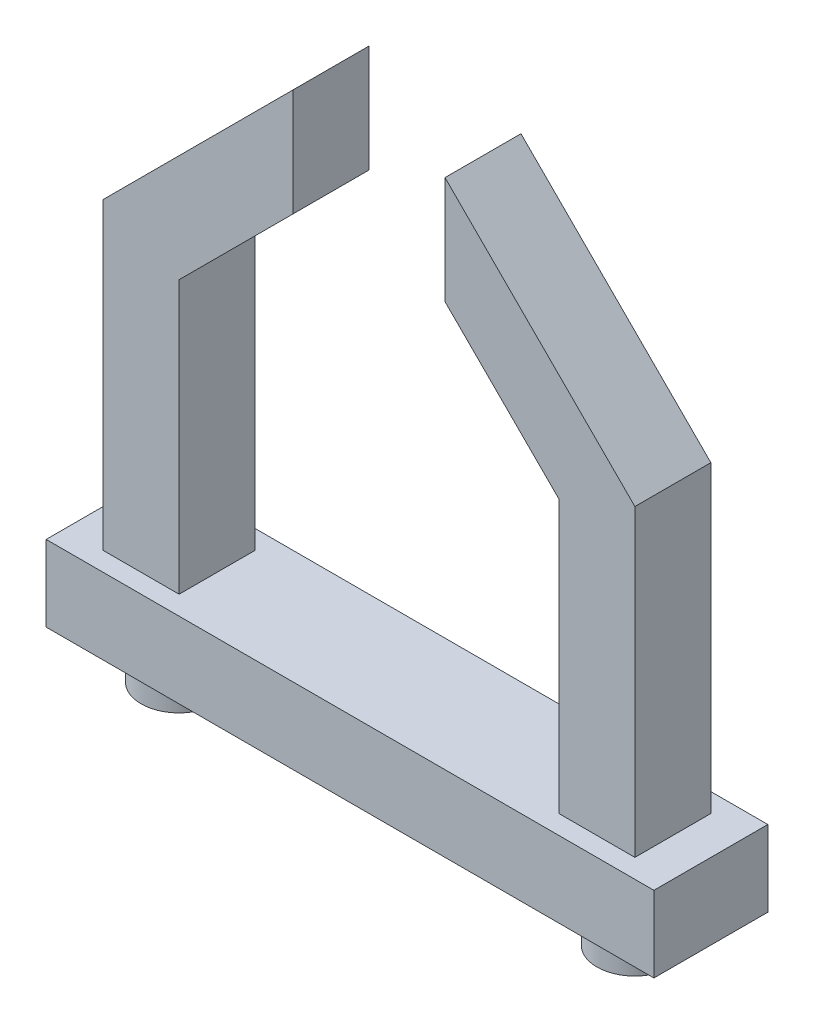
from build123d import *

# Parameters (mm, degrees)
BOSS_EXTRUDE1_DEPTH = 2.5
BOSS_EXTRUDE2_DEPTH = 3.75
SKETCH3_R           = 2.5
BOSS_EXTRUDE3_DEPTH = 2.5


with BuildPart() as part:
    # Sketch1 → Boss-Extrude1 (new, symmetric)
    with BuildSketch(Plane.XY):
        Polygon((-17.5, 25), (-17.5, 5), (-12.5, 5), (-12.5, 22.928932188), (-5, 30.428932188), (-5, 37.5), align=None)
    boss_extrude1 = extrude(amount=BOSS_EXTRUDE1_DEPTH, both=True)

    # Sketch1<3> → Boss-Extrude2 (add, symmetric)
    with BuildSketch(Plane.XY):
        Polygon((-20, 5), (-20, 0), (0, 0), (0, 5), (-12.5, 5), (-17.5, 5), align=None)
    boss_extrude2 = extrude(amount=BOSS_EXTRUDE2_DEPTH, both=True)

    # Sketch3 → Boss-Extrude3 (add)
    with BuildSketch(Plane.XZ):
        with Locations((-15, 0)):
            Circle(SKETCH3_R)
    boss_extrude3 = extrude(amount=BOSS_EXTRUDE3_DEPTH)

    # Mirror1: Boss-Extrude1, Boss-Extrude2, Boss-Extrude3 across plane
    add(boss_extrude1.mirror(Plane(origin=(0, 0, 0), x_dir=(0, 0, 1), z_dir=(1, 0, 0))))
    add(boss_extrude2.mirror(Plane(origin=(0, 0, 0), x_dir=(0, 0, 1), z_dir=(1, 0, 0))))
    add(boss_extrude3.mirror(Plane(origin=(0, 0, 0), x_dir=(0, 0, 1), z_dir=(1, 0, 0))))


solid = part.part
